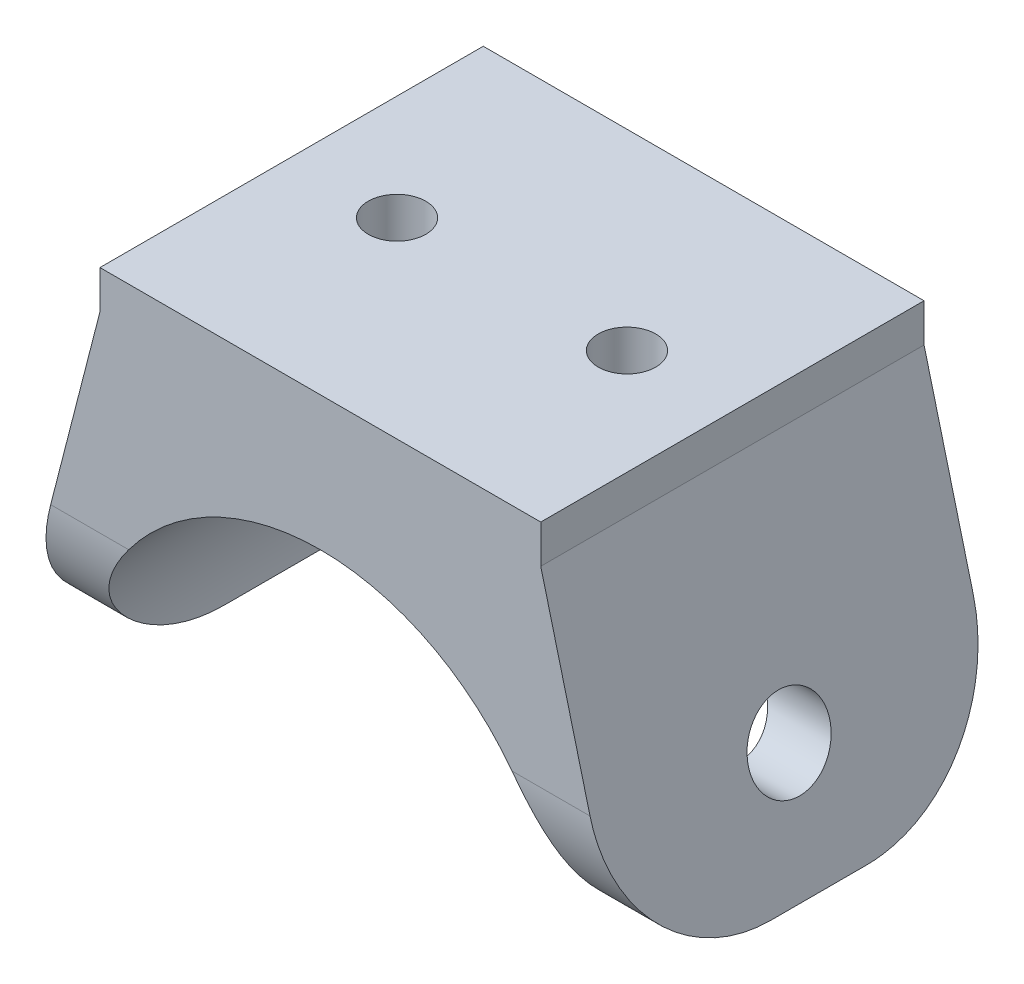
from build123d import *

# Parameters (mm, degrees)
SKETCH1_R           = 4.25
BOSS_EXTRUDE1_DEPTH = 32
CUT_EXTRUDE1_DEPTH  = 64
SKETCH3_R           = 3
CUT_EXTRUDE2_DEPTH  = 14


with BuildPart() as part:
    # Sketch1 → Boss-Extrude1 (new, symmetric)
    with BuildSketch(Plane(origin=(0, 0, 0), x_dir=(0, 0, -1), z_dir=(1, 0, 0))):
        with BuildLine():
            Line((-5, -19.5), (5, -19.5))
            ThreePointArc((5, -19.5), (15.606601718, -15.106601718), (20, -4.5))
            Line((20, -4.5), (20, 19.5))
            Line((20, 19.5), (-20, 19.5))
            Line((-20, 19.5), (-20, -4.5))
            ThreePointArc((-20, -4.5), (-15.606601718, -15.106601718), (-5, -19.5))
        make_face()
        with Locations((0, -7.5)):
            Circle(SKETCH1_R, mode=Mode.SUBTRACT)
    extrude(amount=BOSS_EXTRUDE1_DEPTH, both=True)

    # Sketch2 → Cut-Extrude1 (cut)
    with BuildSketch(Plane.XY.offset(20)):
        Polygon((-23, 15.5), (-23, 19.5), (-32, 19.5), (-32, -19.5), align=None)
        Polygon((32, 19.5), (23, 19.5), (23, 15.5), (32, -19.5), align=None)
        with BuildLine():
            ThreePointArc((25, -19.5), (17.67766953, -1.82233047), (0, 5.5))
            ThreePointArc((0, 5.5), (-17.67766953, -37.17766953), (25, -19.5))
        make_face()
    extrude(amount=-CUT_EXTRUDE1_DEPTH, mode=Mode.SUBTRACT)

    # Sketch3 → Cut-Extrude2 (cut)
    with BuildSketch(Plane(origin=(0, 19.5, 0), x_dir=(1, 0, 0), z_dir=(0, 1, 0))):
        with Locations(Location((-12, 0, 0), (0, 0, 270))):
            Circle(SKETCH3_R)
        with Locations(Location((12, 0, 0), (0, 0, 90))):
            Circle(SKETCH3_R)
    extrude(amount=-CUT_EXTRUDE2_DEPTH, mode=Mode.SUBTRACT)


solid = part.part
